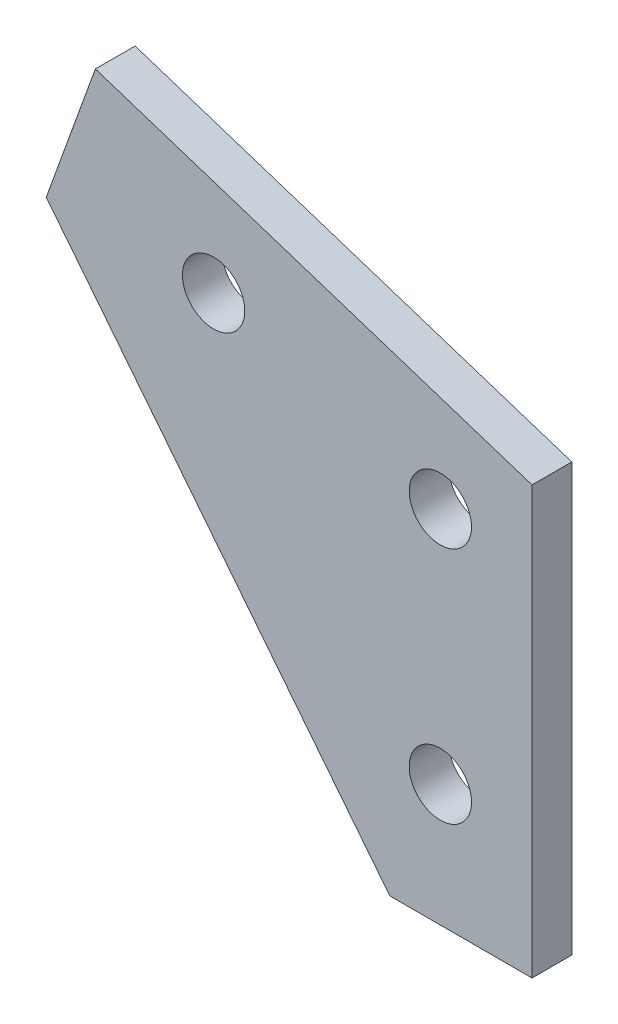
from build123d import *

# Parameters (mm, degrees)
BOSS_EXTRUDE1_DEPTH    = 3.175
F_10_CLEARANCE_HOLE1_D = 4.9784


with BuildPart() as part:
    # Sketch4 → Boss-Extrude1 (new body)
    with BuildSketch(Plane.XY):
        Polygon((-42.187744402, 293.919732514), (-7.296982649, 282.581513931), (-7.296982649, 248.458198081), (-18.653675695, 248.458198081), (-46.113444794, 283.07832781), align=None)
    extrude(amount=BOSS_EXTRUDE1_DEPTH)

    # #10 Clearance Hole1 (through all)
    with Locations(Plane.XY.offset(3.175)):
        with Locations((-32.740251946, 283.138719963), (-14.622625311, 277.25194622), (-14.622625311, 258.20194622)):
            Hole(F_10_CLEARANCE_HOLE1_D / 2)


solid = part.part
